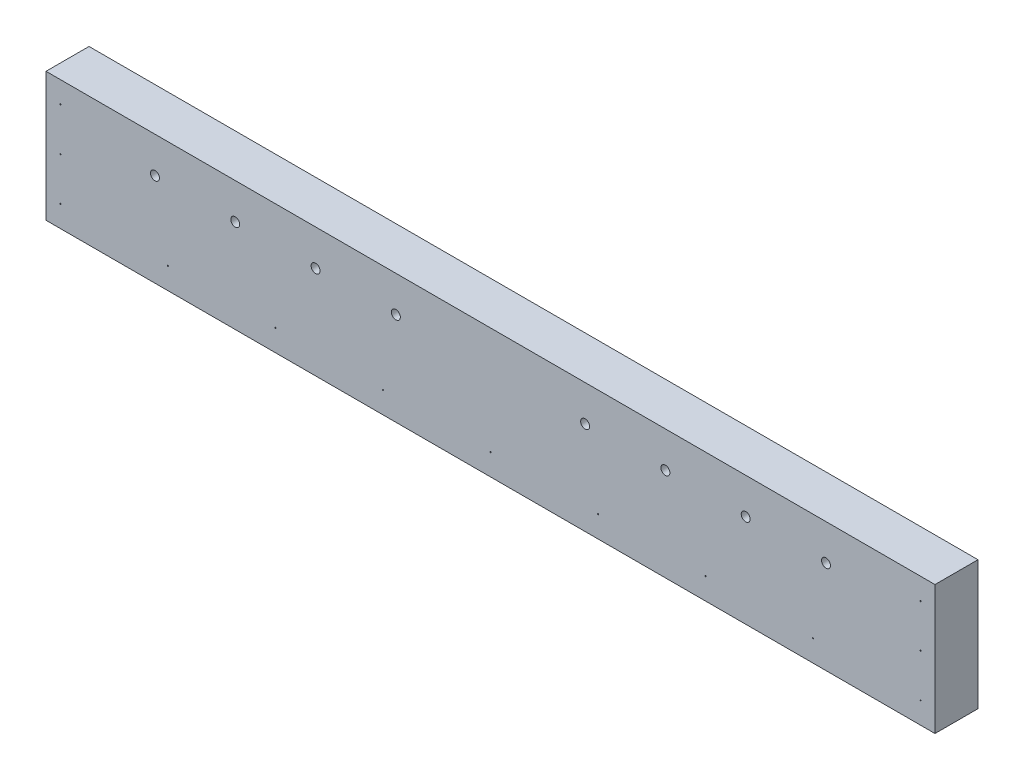
from build123d import *

# Parameters (mm, degrees)
SKETCH1_W           = 1574.8
SKETCH1_H           = 228.6
BOSS_EXTRUDE1_DEPTH = 76.2
SKETCH2_R           = 7.9375
CUT_EXTRUDE1_DEPTH  = 1594.128820906
SKETCH3_R           = 0.9921875
SKETCH3_R_2         = 1.016
CUT_EXTRUDE2_DEPTH  = 76.2


with BuildPart() as part:
    # Sketch1 → Boss-Extrude1 (new body)
    with BuildSketch(Plane.XY):
        with Locations((787.4, 114.3)):
            Rectangle(SKETCH1_W, SKETCH1_H)
    extrude(amount=BOSS_EXTRUDE1_DEPTH)

    # Sketch2 → Cut-Extrude1 (cut, through all)
    with BuildSketch(Plane.XY.offset(76.2)):
        with Locations((193.04, 165.1)):
            Circle(SKETCH2_R)
        with Locations((335.28, 165.1)):
            Circle(SKETCH2_R)
        with Locations((477.52, 165.1)):
            Circle(SKETCH2_R)
        with Locations((619.76, 165.1)):
            Circle(SKETCH2_R)
        with Locations((955.04, 165.1)):
            Circle(SKETCH2_R)
        with Locations((1097.28, 165.1)):
            Circle(SKETCH2_R)
        with Locations((1239.52, 165.1)):
            Circle(SKETCH2_R)
        with Locations((1381.76, 165.1)):
            Circle(SKETCH2_R)
    extrude(amount=-CUT_EXTRUDE1_DEPTH, mode=Mode.SUBTRACT)

    # Sketch3 → Cut-Extrude2 (cut)
    with BuildSketch(Plane.XY.offset(76.2)):
        with Locations((1549.4, 38.1)):
            Circle(SKETCH3_R)
        with Locations((1549.4, 190.5)):
            Circle(SKETCH3_R_2)
        with Locations((1549.4, 114.3)):
            Circle(SKETCH3_R_2)
        with Locations((25.4, 38.1)):
            Circle(SKETCH3_R)
        with Locations((25.4, 114.3)):
            Circle(SKETCH3_R_2)
        with Locations((25.4, 190.5)):
            Circle(SKETCH3_R_2)
        with Locations((215.9, 38.1)):
            Circle(SKETCH3_R_2)
        with Locations((406.4, 38.1)):
            Circle(SKETCH3_R_2)
        with Locations((596.9, 38.1)):
            Circle(SKETCH3_R_2)
        with Locations((787.4, 38.1)):
            Circle(SKETCH3_R_2)
        with Locations((977.9, 38.1)):
            Circle(SKETCH3_R_2)
        with Locations((1168.4, 38.1)):
            Circle(SKETCH3_R_2)
        with Locations((1358.9, 38.1)):
            Circle(SKETCH3_R_2)
    extrude(amount=-CUT_EXTRUDE2_DEPTH, mode=Mode.SUBTRACT)


solid = part.part
